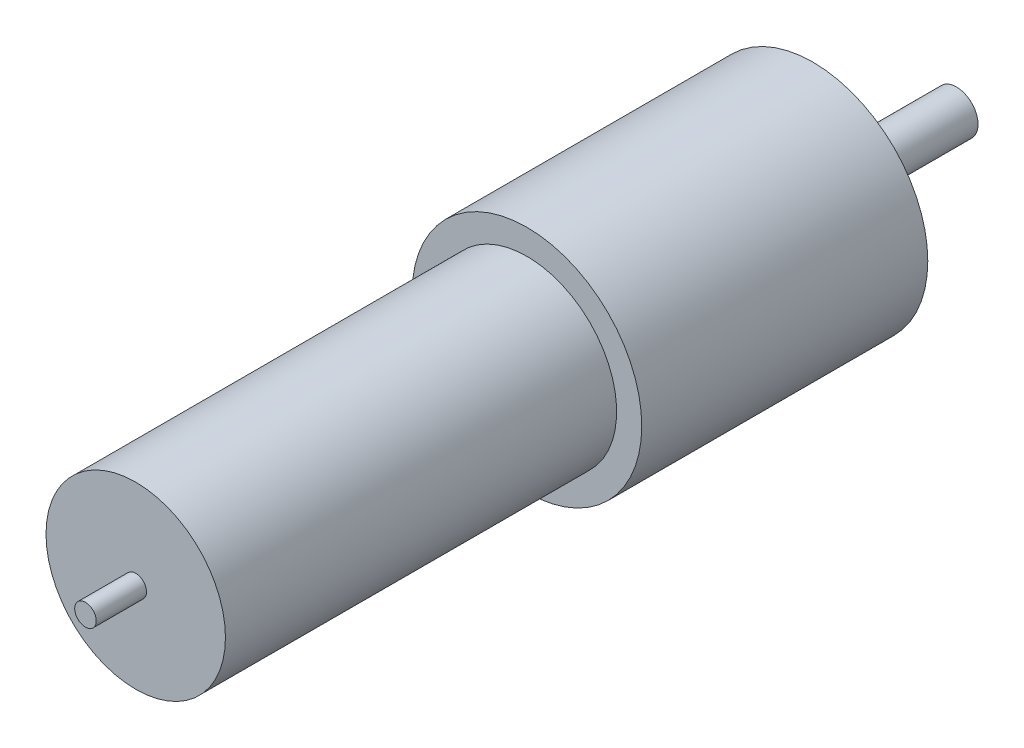
from build123d import *

# Parameters (mm, degrees)
ESQUISSE1_R        = 12.5
BOSS_EXTRU_1_DEPTH = 54.5
ESQUISSE2_R        = 1.5
BOSS_EXTRU_2_DEPTH = 7
ESQUISSE3_R        = 16
BOSS_EXTRU_3_DEPTH = 39.85
ESQUISSE4_R        = 3
BOSS_EXTRU_8_DEPTH = 20


with BuildPart() as part:
    # Esquisse1 → Boss.-Extru.1 (new body)
    with BuildSketch(Plane.XY):
        Circle(ESQUISSE1_R)
    extrude(amount=BOSS_EXTRU_1_DEPTH)

    # Esquisse2 → Boss.-Extru.2 (add)
    with BuildSketch(Plane.XY.offset(54.5)):
        Circle(ESQUISSE2_R)
    extrude(amount=BOSS_EXTRU_2_DEPTH)

    # Esquisse3 → Boss.-Extru.3 (add)
    with BuildSketch(Plane(origin=(0, 0, 0), x_dir=(-1, 0, 0), z_dir=(0, 0, -1))):
        Circle(ESQUISSE3_R)
    extrude(amount=BOSS_EXTRU_3_DEPTH)

    # Esquisse4 → Boss.-Extru.8 (add)
    with BuildSketch(Plane(origin=(0, 0, -39.85), x_dir=(-1, 0, 0), z_dir=(0, 0, -1))):
        Circle(ESQUISSE4_R)
    extrude(amount=BOSS_EXTRU_8_DEPTH)


solid = part.part
